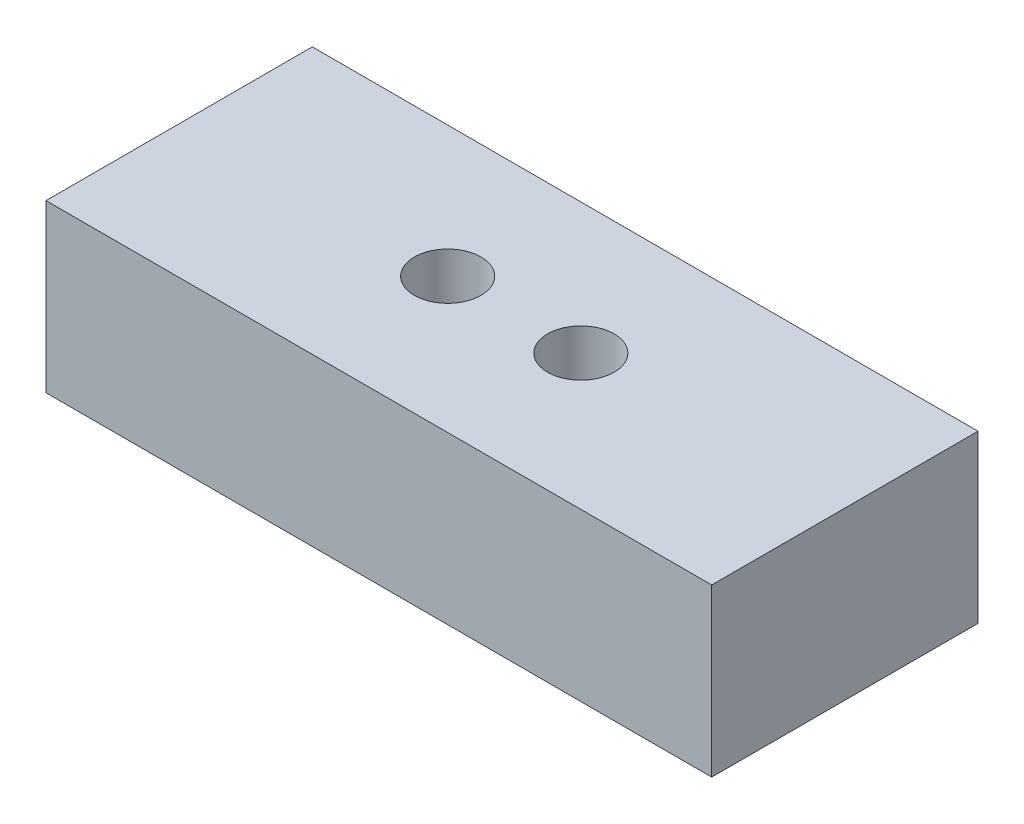
from build123d import *

# Parameters (mm, degrees)
SKETCH1_W           = 100
SKETCH1_H           = 40
BOSS_EXTRUDE1_DEPTH = 25
SKETCH2_R           = 5
CUT_EXTRUDE1_DEPTH  = 10


with BuildPart() as part:
    # Sketch1 → Boss-Extrude1 (new body)
    with BuildSketch(Plane(origin=(0, 0, 0), x_dir=(1, 0, 0), z_dir=(0, 1, 0))):
        with Locations((-45.886524823, -1.70212766)):
            Rectangle(SKETCH1_W, SKETCH1_H)
    extrude(amount=BOSS_EXTRUDE1_DEPTH)

    # Sketch2 → Cut-Extrude1 (cut)
    with BuildSketch(Plane(origin=(0, 25, 0), x_dir=(1, 0, 0), z_dir=(0, 1, 0))):
        with Locations(Location((-55.886524823, -1.36175409, 0), (0, 0, 270))):
            Circle(SKETCH2_R)
        with Locations(Location((-35.886524823, -1.36175409, 0), (0, 0, 270))):
            Circle(SKETCH2_R)
    extrude(amount=-CUT_EXTRUDE1_DEPTH, mode=Mode.SUBTRACT)


solid = part.part
